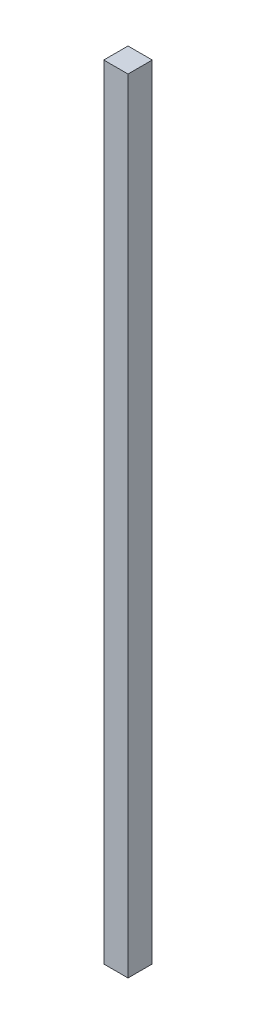
from build123d import *

# Parameters (mm, degrees)
SKETCH1_W           = 2258.06
SKETCH1_H           = 72903.08
BOSS_EXTRUDE1_DEPTH = 2258.06
SCALE1_SCALE        = 0.039370079


with BuildPart() as part:
    # Sketch1 → Boss-Extrude1 (new body)
    with BuildSketch(Plane.XY):
        Rectangle(SKETCH1_W, SKETCH1_H)
    extrude(amount=BOSS_EXTRUDE1_DEPTH)


with BuildPart() as part_1:
    # Scale1: scaled about (0, 0, 1129.03)
    add(part.part.scale(SCALE1_SCALE).moved(Location((0, 0, 1084.58))))


solid = part_1.part
